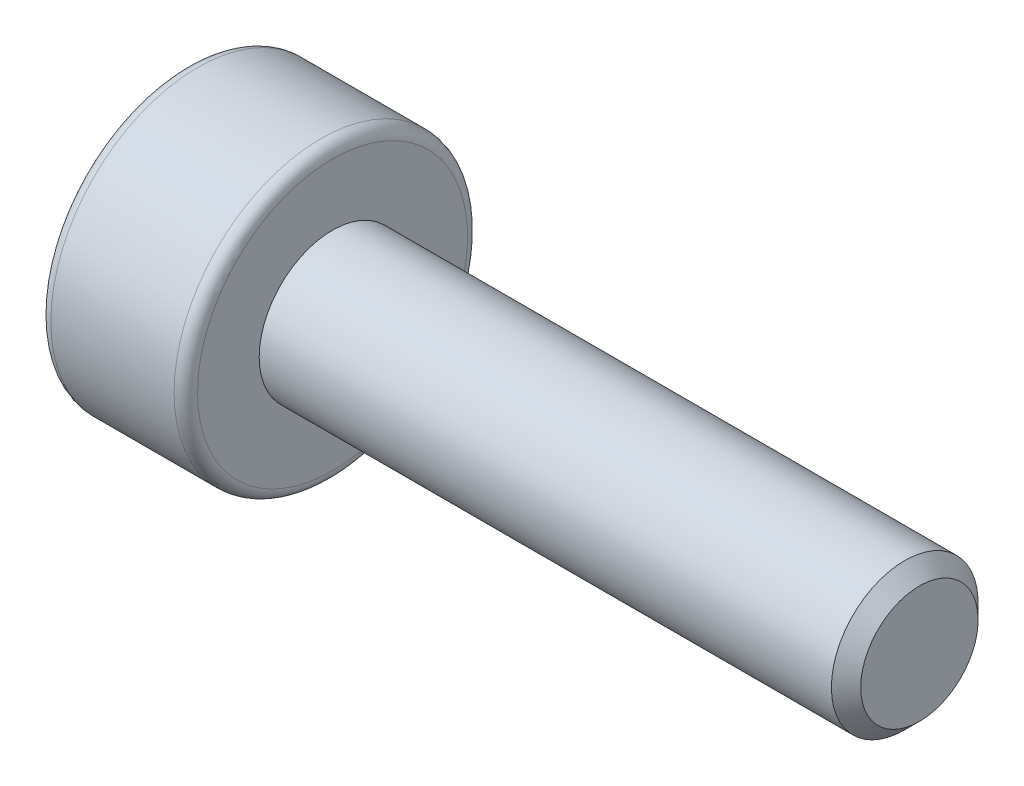
from build123d import *

# Parameters (mm, degrees)
CUT_EXTRUDE1_DEPTH = 0.8


with BuildPart() as part:
    # Sketch2 → Revolve1 (revolve)
    with BuildSketch(Plane.XY, mode=Mode.PRIVATE) as revolve1_sk:
        with BuildLine():
            Line((0, 0), (0, 2.3))
            ThreePointArc((0, 2.3), (0.058578644, 2.441421356), (0.2, 2.5))
            Line((0.2, 2.5), (2.3, 2.5))
            ThreePointArc((2.3, 2.5), (2.441421356, 2.441421356), (2.5, 2.3))
            Line((2.5, 2.3), (2.5, 1.25))
            Line((2.5, 1.25), (12.25, 1.25))
            Line((12.25, 1.25), (12.5, 1))
            Line((12.5, 1), (12.5, 0))
            Line((12.5, 0), (0, 0))
        make_face()
    revolve(revolve1_sk.sketch.rotate(Axis((-2.281841559, 0, 0), (1, 0, 0)), 90), axis=Axis((-2.281841559, 0, 0), (1, 0, 0)))

    # Sketch3 → Cut-Extrude1 (cut)
    with BuildSketch(Plane.ZY):
        Polygon((0.577350269, -1), (1.154700538, 0), (0.577350269, 1), (-0.577350269, 1), (-1.154700538, 0), (-0.577350269, -1), align=None)
    extrude(amount=-CUT_EXTRUDE1_DEPTH, mode=Mode.SUBTRACT)


solid = part.part
